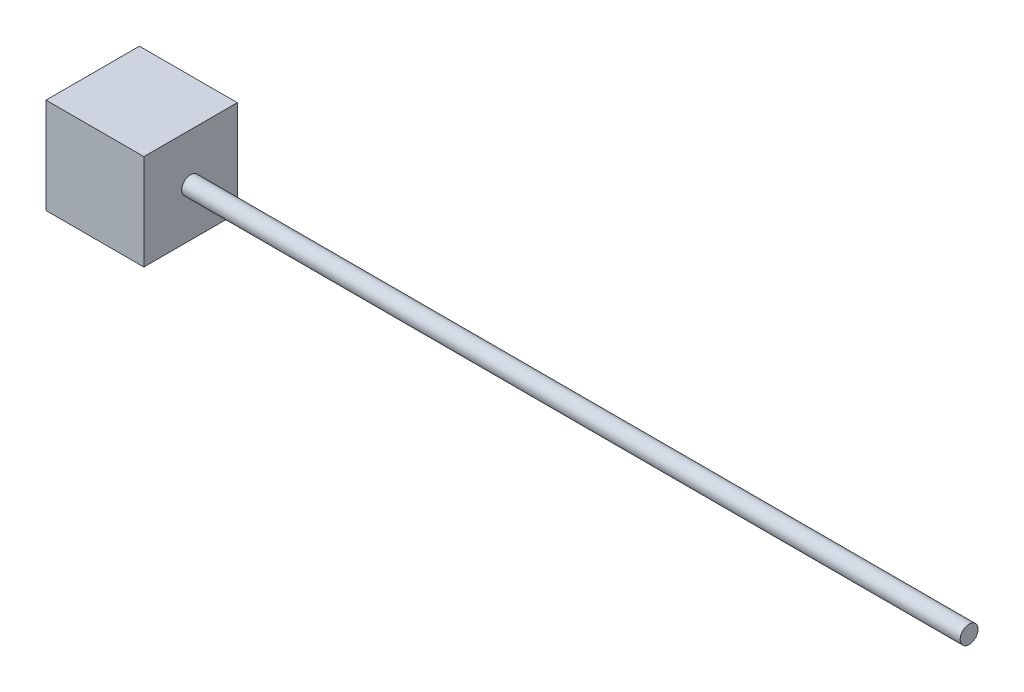
from build123d import *

# Parameters (mm, degrees)
CROQUIS1_W              = 44
CROQUIS1_H              = 42
SALIENTE_EXTRUIR1_DEPTH = 21.5
CROQUIS2_R              = 4
SALIENTE_EXTRUIR2_DEPTH = 350


with BuildPart() as part:
    # Croquis1 → Saliente-Extruir1 (new, symmetric)
    with BuildSketch(Plane(origin=(0, 0, 0), x_dir=(1, 0, 0), z_dir=(0, 1, 0))):
        Rectangle(CROQUIS1_W, CROQUIS1_H)
    extrude(amount=SALIENTE_EXTRUIR1_DEPTH, both=True)

    # Croquis2 → Saliente-Extruir2 (add)
    with BuildSketch(Plane(origin=(22, 0, 0), x_dir=(0, 0, -1), z_dir=(1, 0, 0))):
        with Locations(Location((0, 0, 0), (0, 0, 180))):
            Circle(CROQUIS2_R)
    extrude(amount=SALIENTE_EXTRUIR2_DEPTH)


solid = part.part
